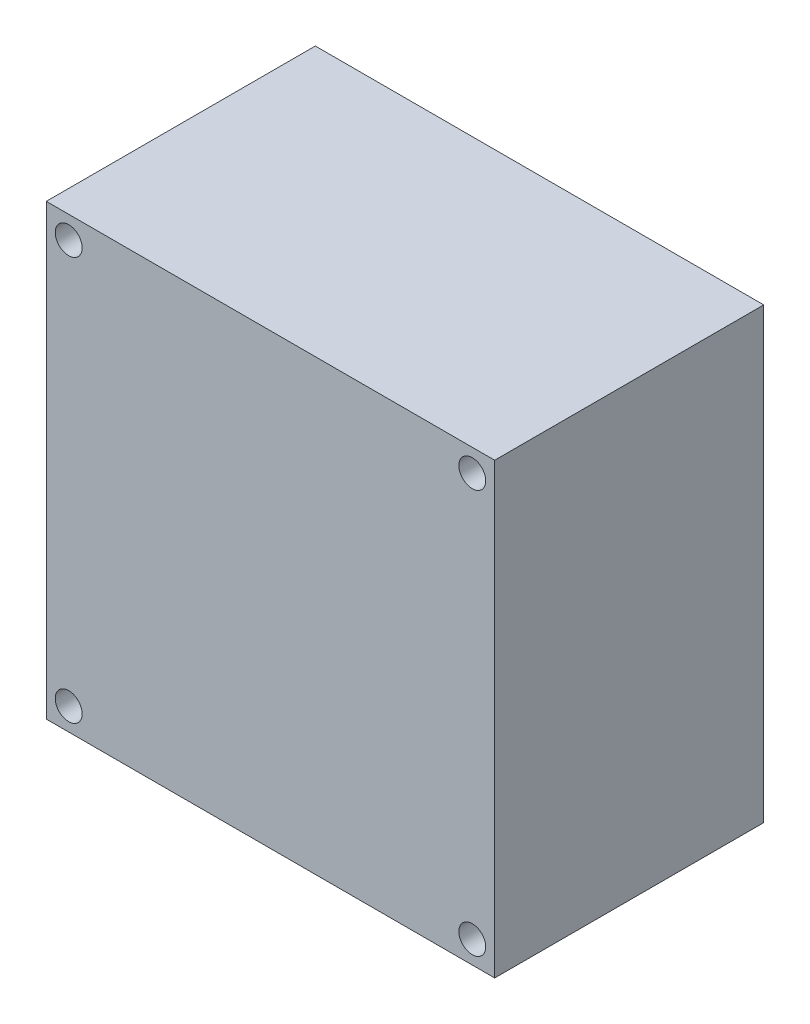
from build123d import *

# Parameters (mm, degrees)
ESQUISSE1_W        = 50
ESQUISSE1_H        = 50
ESQUISSE1_R        = 1.5
BOSS_EXTRU_1_DEPTH = 30


with BuildPart() as part:
    # Esquisse1 → Boss.-Extru.1 (new body)
    with BuildSketch(Plane.XY):
        with Locations((-9.988193646, 189.599490363)):
            Rectangle(ESQUISSE1_W, ESQUISSE1_H)
        with Locations((12.511806354, 167.099490363)):
            Circle(ESQUISSE1_R, mode=Mode.SUBTRACT)
        with Locations((-32.488193646, 167.099490363)):
            Circle(ESQUISSE1_R, mode=Mode.SUBTRACT)
        with Locations((12.511806354, 212.099490363)):
            Circle(ESQUISSE1_R, mode=Mode.SUBTRACT)
        with Locations((-32.488193646, 212.099490363)):
            Circle(ESQUISSE1_R, mode=Mode.SUBTRACT)
    extrude(amount=BOSS_EXTRU_1_DEPTH)


solid = part.part
